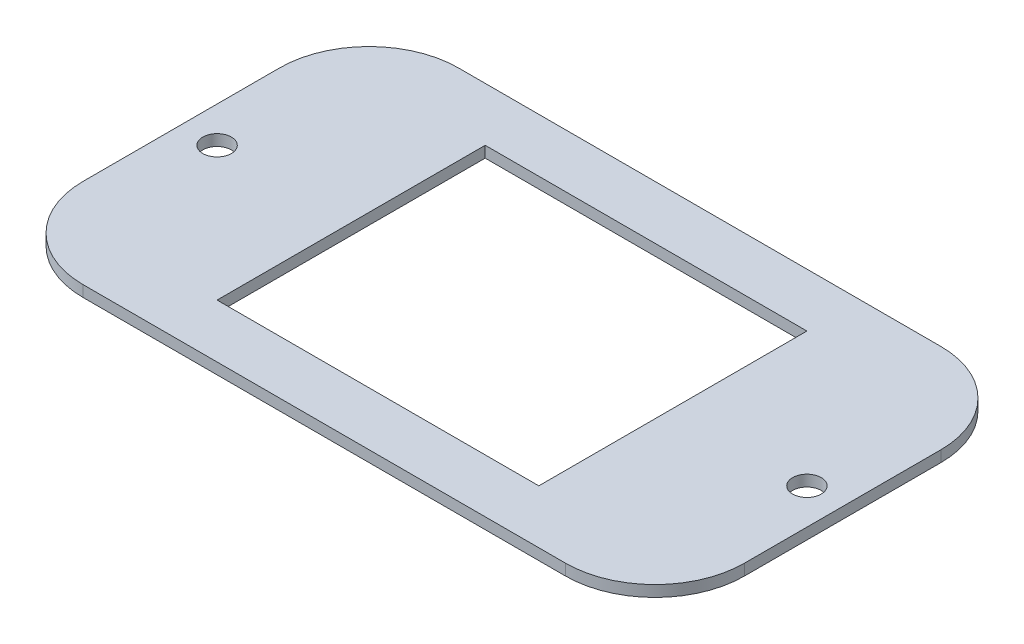
from build123d import *

# Parameters (mm, degrees)
SKETCH1_W           = 74
SKETCH1_H           = 42
SKETCH1_R           = 1.6
SKETCH1_W_2         = 36
SKETCH1_H_2         = 30
BOSS_EXTRUDE1_DEPTH = 1.25
FILLET1_R           = 10


with BuildPart() as part:
    # Sketch1 → Boss-Extrude1 (new body)
    with BuildSketch(Plane(origin=(0, 0, 0), x_dir=(1, 0, 0), z_dir=(0, 1, 0))):
        Rectangle(SKETCH1_W, SKETCH1_H)
        with Locations(Location((-33, 0, 0), (0, 0, 270))):
            Circle(SKETCH1_R, mode=Mode.SUBTRACT)
        with Locations(Location((33, 0, 0), (0, 0, 90))):
            Circle(SKETCH1_R, mode=Mode.SUBTRACT)
        Rectangle(SKETCH1_W_2, SKETCH1_H_2, mode=Mode.SUBTRACT)
    extrude(amount=BOSS_EXTRUDE1_DEPTH)

    # Fillet1
    fillet1_edges = [part.edges().sort_by_distance(p)[0] for p in [
        (37, 0.625, 21),
        (-37, 0.625, 21),
        (-37, 0.625, -21),
        (37, 0.625, -21),
    ]]
    fillet(fillet1_edges, radius=FILLET1_R)


solid = part.part
